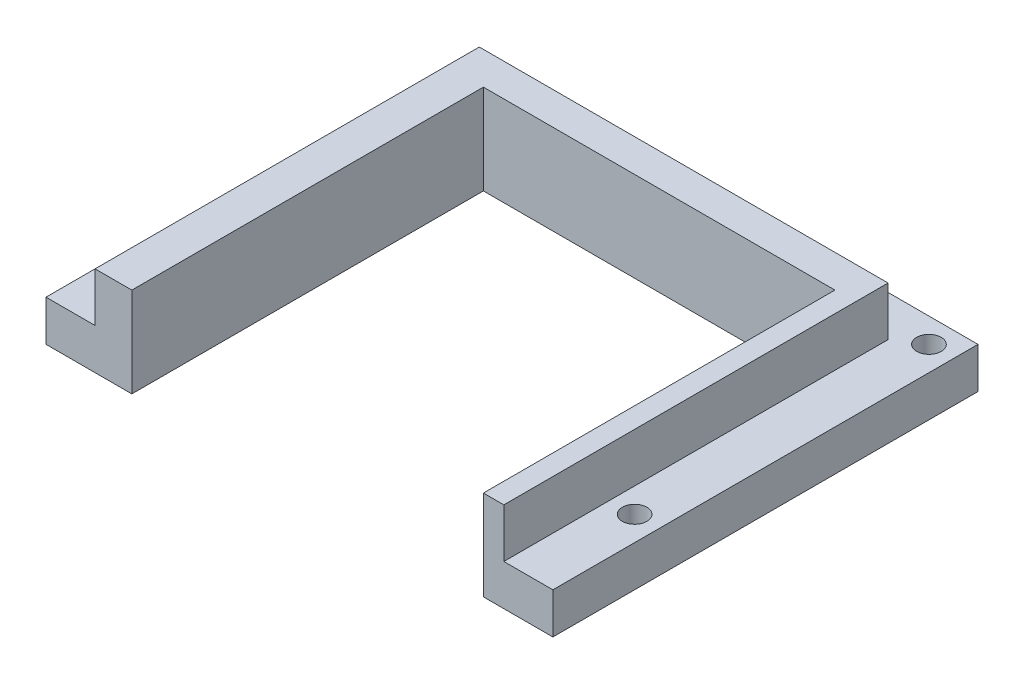
from build123d import *

# Parameters (mm, degrees)
IZIM1_R                     = 1.5
Y_KSEKLIK_EKSTR_ZYON1_DEPTH = 5
IZIM1_3_W                   = 50
IZIM1_3_H                   = 47
IZIM1_3_R                   = 2
Y_KSEKLIK_EKSTR_ZYON2_DEPTH = 11
IZIM4_W                     = 43
IZIM4_H                     = 43
IZIM4_R                     = 2
KES_EKSTR_ZYON9_DEPTH       = 20


with BuildPart() as part:
    # Çizim1 → Yükseklik-Ekstrüzyon1 (new body)
    with BuildSketch(Plane(origin=(0, 0, 0), x_dir=(1, 0, 0), z_dir=(0, 1, 0))):
        Polygon((0, 52), (0, 0), (6, 0), (6, 47), (56, 47), (56, 0), (62, 0), (62, 52), align=None)
        with Locations((3, 13)):
            Circle(IZIM1_R, mode=Mode.SUBTRACT)
        with Locations((59, 13)):
            Circle(IZIM1_R, mode=Mode.SUBTRACT)
        with Locations((3, 49)):
            Circle(IZIM1_R, mode=Mode.SUBTRACT)
        with Locations((59, 49)):
            Circle(IZIM1_R, mode=Mode.SUBTRACT)
    extrude(amount=Y_KSEKLIK_EKSTR_ZYON1_DEPTH)

    # Çizim1<3> → Yükseklik-Ekstrüzyon2 (add)
    with BuildSketch(Plane(origin=(0, 0, 0), x_dir=(1, 0, 0), z_dir=(0, 1, 0))):
        with Locations((31, 23.5)):
            Rectangle(IZIM1_3_W, IZIM1_3_H)
        with Locations((16.5, 5.5)):
            Circle(IZIM1_3_R, mode=Mode.SUBTRACT)
        with Locations((47.5, 5.5)):
            Circle(IZIM1_3_R, mode=Mode.SUBTRACT)
        with Locations((16.5, 36.5)):
            Circle(IZIM1_3_R, mode=Mode.SUBTRACT)
        with Locations((47.5, 36.5)):
            Circle(IZIM1_3_R, mode=Mode.SUBTRACT)
    extrude(amount=Y_KSEKLIK_EKSTR_ZYON2_DEPTH)

    # Çizim4 → Kes-Ekstrüzyon9 (cut)
    with BuildSketch(Plane(origin=(0, 0, 0), x_dir=(1, 0, 0), z_dir=(0, 1, 0))):
        with Locations((32, 21.5)):
            Rectangle(IZIM4_W, IZIM4_H)
        with Locations((16.5, 36.5)):
            Circle(IZIM4_R, mode=Mode.SUBTRACT)
        with Locations((47.5, 36.5)):
            Circle(IZIM4_R, mode=Mode.SUBTRACT)
        with Locations((47.5, 5.5)):
            Circle(IZIM4_R, mode=Mode.SUBTRACT)
        with Locations((16.5, 5.5)):
            Circle(IZIM4_R, mode=Mode.SUBTRACT)
    extrude(amount=KES_EKSTR_ZYON9_DEPTH, mode=Mode.SUBTRACT)


solid = part.part
